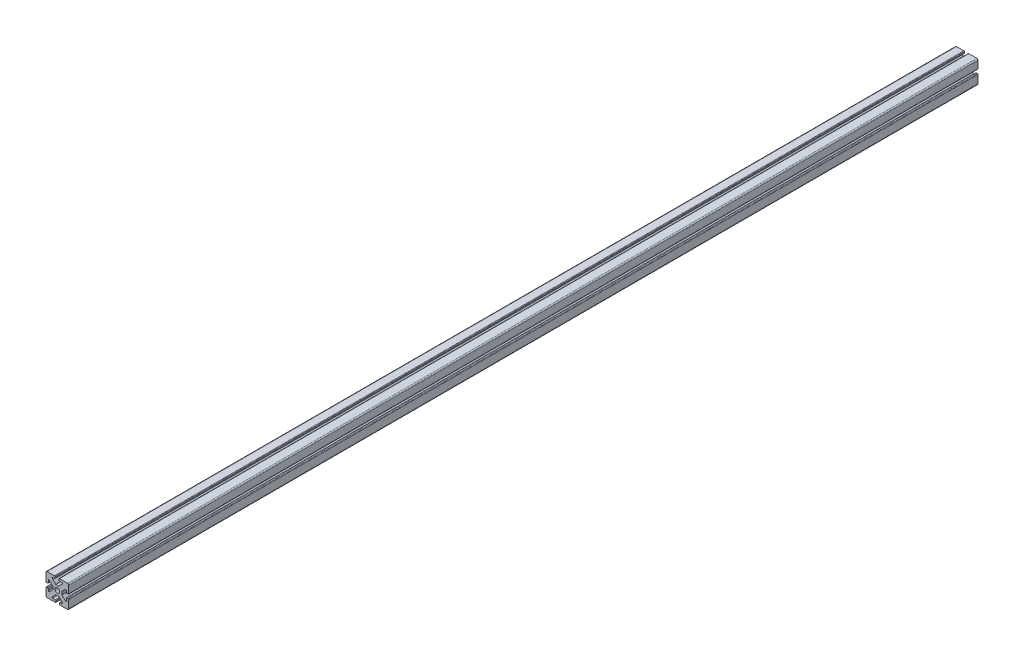
from build123d import *

# Parameters (mm, degrees)
SKETCH_1_W               = 40
SKETCH_1_H               = 40
EXTRUDE_1_DEPTH          = 1605.02
SKETCH_2_R               = 4.05
CUT_EXTRUDE_1_DEPTH      = 10000
CUT_EXTRUDE_2_DEPTH      = 10000
FILLET_1_R               = 1
PATTERN_CIRCULAR_2_COUNT = 4
FILLET_2_R               = 1
FILLET_3_R               = 1
FILLET_4_R               = 1
FILLET_5_R               = 2


with BuildPart() as part:
    # 草图1 → 凸台-拉伸1 (new body)
    with BuildSketch(Plane.XY):
        Rectangle(SKETCH_1_W, SKETCH_1_H)
    extrude(amount=EXTRUDE_1_DEPTH)

    # 草图2 → 切除-拉伸1 (cut)
    with BuildSketch(Plane.XY.offset(1605.02)):
        Circle(SKETCH_2_R)
    extrude(amount=-CUT_EXTRUDE_1_DEPTH, mode=Mode.SUBTRACT)

    # 草图4 → 切除-拉伸2 (cut)
    with BuildSketch(Plane.XY.offset(1605.02)):
        Polygon((20, 0), (20, 4), (16, 4), (16, 10.5), (7.876860985, 2.6), (7.876860985, -2.6), (16, -10.5), (16, -2.65197969), (20, -2.65197969), align=None)
    cut_extrude_2 = extrude(amount=-CUT_EXTRUDE_2_DEPTH, mode=Mode.SUBTRACT)

    # 圆角1
    fillet_1_edges = [part.edges().sort_by_distance(p)[0] for p in [
        (20, -2.65197969, 802.51),
        (16, -2.65197969, 802.51),
        (16, -10.5, 802.51),
        (7.876860985, -2.6, 802.51),
        (7.876860985, 2.6, 802.51),
        (16, 10.5, 802.51),
        (16, 4, 802.51),
        (20, 4, 802.51),
    ]]
    fillet(fillet_1_edges, radius=FILLET_1_R)

    # 阵列(圆周)2: 切除-拉伸2 ×4 about axis
    pattern_circular_2_axis = Axis((0, 0, 0), (0, 0, 1))
    for i in range(1, PATTERN_CIRCULAR_2_COUNT):
        add(cut_extrude_2.rotate(pattern_circular_2_axis, i * 360 / PATTERN_CIRCULAR_2_COUNT), mode=Mode.SUBTRACT)

    # 圆角2
    fillet_2_edges = [part.edges().sort_by_distance(p)[0] for p in [
        (2.65197969, 20, 802.51),
        (2.65197969, 16, 802.51),
        (10.5, 16, 802.51),
        (2.6, 7.876860985, 802.51),
        (-2.6, 7.876860985, 802.51),
        (-10.5, 16, 802.51),
        (-4, 16, 802.51),
        (-4, 20, 802.51),
    ]]
    fillet(fillet_2_edges, radius=FILLET_2_R)

    # 圆角3
    fillet_3_edges = [part.edges().sort_by_distance(p)[0] for p in [
        (-20, 2.65197969, 802.51),
        (-16, 2.65197969, 802.51),
        (-16, 10.5, 802.51),
        (-7.876860985, 2.6, 802.51),
        (-7.876860985, -2.6, 802.51),
        (-16, -10.5, 802.51),
        (-16, -4, 802.51),
        (-20, -4, 802.51),
    ]]
    fillet(fillet_3_edges, radius=FILLET_3_R)

    # 圆角4
    fillet_4_edges = [part.edges().sort_by_distance(p)[0] for p in [
        (-2.65197969, -20, 802.51),
        (-2.65197969, -16, 802.51),
        (-10.5, -16, 802.51),
        (-2.6, -7.876860985, 802.51),
        (2.6, -7.876860985, 802.51),
        (10.5, -16, 802.51),
        (4, -16, 802.51),
        (4, -20, 802.51),
    ]]
    fillet(fillet_4_edges, radius=FILLET_4_R)

    # 圆角5
    fillet_5_edges = [part.edges().sort_by_distance(p)[0] for p in [
        (20, -20, 802.51),
        (-20, -20, 802.51),
        (-20, 20, 802.51),
        (20, 20, 802.51),
    ]]
    fillet(fillet_5_edges, radius=FILLET_5_R)


solid = part.part
